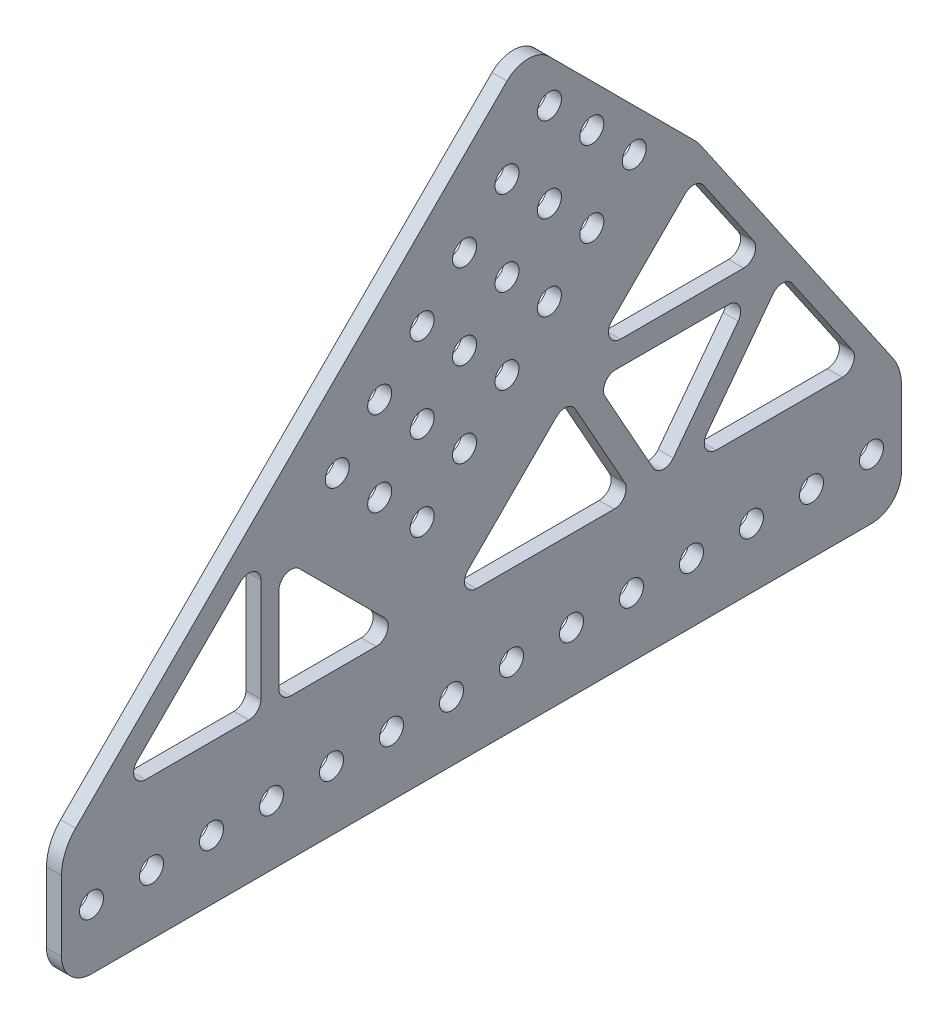
from build123d import *

# Parameters (mm, degrees)
SKETCH8_R           = 2.54
BOSS_EXTRUDE1_DEPTH = 3.175
FILLET1_R           = 2.54
FILLET2_R           = 6.35
FILLET3_R           = 10.16
FILLET4_R           = 12.7


with BuildPart() as part:
    # Sketch8 → Boss-Extrude1 (new body)
    with BuildSketch(Plane(origin=(0, 0, 0), x_dir=(0, 0, -1), z_dir=(1, 0, 0))):
        Polygon((181.332817332, 194.032817332), (217.253841816, 158.111792847), (260.35, 95.25), (260.35, 69.85), (82.55, 69.85), (82.55, 95.25), align=None)
        with Locations((185.822945392, 144.641408666)):
            Circle(SKETCH8_R, mode=Mode.SUBTRACT)
        with Locations((167.86243315, 162.601920908)):
            Circle(SKETCH8_R, mode=Mode.SUBTRACT)
        with Locations((167.86243315, 144.641408666)):
            Circle(SKETCH8_R, mode=Mode.SUBTRACT)
        with Locations((158.882177029, 135.661152545)):
            Circle(SKETCH8_R, mode=Mode.SUBTRACT)
        with Locations((158.882177029, 153.621664787)):
            Circle(SKETCH8_R, mode=Mode.SUBTRACT)
        with Locations((149.901920908, 144.641408666)):
            Circle(SKETCH8_R, mode=Mode.SUBTRACT)
        with Locations((140.921664787, 135.661152545)):
            Circle(SKETCH8_R, mode=Mode.SUBTRACT)
        with Locations((149.901920908, 126.680896424)):
            Circle(SKETCH8_R, mode=Mode.SUBTRACT)
        with Locations((158.882177029, 117.700640303)):
            Circle(SKETCH8_R, mode=Mode.SUBTRACT)
        with Locations((167.86243315, 126.680896424)):
            Circle(SKETCH8_R, mode=Mode.SUBTRACT)
        with Locations((176.842689271, 135.661152545)):
            Circle(SKETCH8_R, mode=Mode.SUBTRACT)
        with Locations((176.842689271, 153.621664787)):
            Circle(SKETCH8_R, mode=Mode.SUBTRACT)
        with Locations((194.803201513, 153.621664787)):
            Circle(SKETCH8_R, mode=Mode.SUBTRACT)
        with Locations((203.783457634, 162.601920908)):
            Circle(SKETCH8_R, mode=Mode.SUBTRACT)
        with Locations((194.803201513, 171.582177029)):
            Circle(SKETCH8_R, mode=Mode.SUBTRACT)
        with Locations((185.822945392, 180.56243315)):
            Circle(SKETCH8_R, mode=Mode.SUBTRACT)
        with Locations((176.842689271, 171.582177029)):
            Circle(SKETCH8_R, mode=Mode.SUBTRACT)
        with Locations((185.822945392, 162.601920908)):
            Circle(SKETCH8_R, mode=Mode.SUBTRACT)
        with Locations((254, 82.55)):
            Circle(SKETCH8_R, mode=Mode.SUBTRACT)
        with Locations((241.3, 82.55)):
            Circle(SKETCH8_R, mode=Mode.SUBTRACT)
        with Locations((228.6, 82.55)):
            Circle(SKETCH8_R, mode=Mode.SUBTRACT)
        with Locations((215.9, 82.55)):
            Circle(SKETCH8_R, mode=Mode.SUBTRACT)
        with Locations((203.2, 82.55)):
            Circle(SKETCH8_R, mode=Mode.SUBTRACT)
        with Locations((190.5, 82.55)):
            Circle(SKETCH8_R, mode=Mode.SUBTRACT)
        with Locations((177.8, 82.55)):
            Circle(SKETCH8_R, mode=Mode.SUBTRACT)
        with Locations((165.1, 82.55)):
            Circle(SKETCH8_R, mode=Mode.SUBTRACT)
        with Locations((152.4, 82.55)):
            Circle(SKETCH8_R, mode=Mode.SUBTRACT)
        with Locations((139.7, 82.55)):
            Circle(SKETCH8_R, mode=Mode.SUBTRACT)
        with Locations((127, 82.55)):
            Circle(SKETCH8_R, mode=Mode.SUBTRACT)
        with Locations((114.3, 82.55)):
            Circle(SKETCH8_R, mode=Mode.SUBTRACT)
        with Locations((101.6, 82.55)):
            Circle(SKETCH8_R, mode=Mode.SUBTRACT)
        with Locations((88.9, 82.55)):
            Circle(SKETCH8_R, mode=Mode.SUBTRACT)
        Polygon((164.270330702, 99.740128061), (203.862933209, 99.740128061), (189.670330702, 125.140128061), align=None, mode=Mode.SUBTRACT)
        Polygon((209.682177029, 99.740128061), (195.489574522, 125.140128061), (228.872016188, 125.140128061), align=None, mode=Mode.SUBTRACT)
        Polygon((216.048997042, 99.740128061), (252.652313741, 99.740128061), (235.238836201, 125.140128061), align=None, mode=Mode.SUBTRACT)
        Polygon((194.750330702, 130.220128061), (231.756140693, 130.220128061), (216.70480924, 152.174606599), align=None, mode=Mode.SUBTRACT)
        Polygon((124.757203769, 130.272998872), (94.224332957, 99.740128061), (124.757203769, 99.740128061), align=None, mode=Mode.SUBTRACT)
        Polygon((128.567203769, 126.462998872), (128.567203769, 99.740128061), (155.290074581, 99.740128061), align=None, mode=Mode.SUBTRACT)
    extrude(amount=BOSS_EXTRUDE1_DEPTH)

    # Fillet1
    fillet1_edges = [part.edges().sort_by_distance(p)[0] for p in [
        (1.5875, 125.140128061, -195.489574522),
        (1.5875, 99.740128061, -209.682177029),
        (1.5875, 125.140128061, -228.872016188),
        (1.5875, 99.740128061, -164.270330702),
        (1.5875, 99.740128061, -203.862933209),
        (1.5875, 125.140128061, -189.670330702),
        (1.5875, 99.740128061, -216.048997042),
        (1.5875, 99.740128061, -252.652313741),
        (1.5875, 125.140128061, -235.238836201),
        (1.5875, 130.220128061, -194.750330702),
        (1.5875, 130.220128061, -231.756140693),
        (1.5875, 152.174606599, -216.70480924),
        (1.5875, 130.272998872, -124.757203769),
        (1.5875, 99.740128061, -94.224332957),
        (1.5875, 99.740128061, -124.757203769),
        (1.5875, 126.462998872, -128.567203769),
        (1.5875, 99.740128061, -128.567203769),
        (1.5875, 99.740128061, -155.290074581),
    ]]
    fillet(fillet1_edges, radius=FILLET1_R)

    # Fillet2
    fillet2_edges = [part.edges().sort_by_distance(p)[0] for p in [
        (1.5875, 69.85, -260.35),
        (1.5875, 69.85, -82.55),
        (1.5875, 194.032817332, -181.332817332),
    ]]
    fillet(fillet2_edges, radius=FILLET2_R)

    # Fillet3
    fillet3_edges = [part.edges().sort_by_distance(p)[0] for p in [
        (1.5875, 95.25, -82.55),
        (1.5875, 95.25, -260.35),
    ]]
    fillet(fillet3_edges, radius=FILLET3_R)

    # Fillet4
    fillet4_edges = [part.edges().sort_by_distance(p)[0] for p in [
        (1.5875, 158.111792847, -217.253841816),
    ]]
    fillet(fillet4_edges, radius=FILLET4_R)


solid = part.part
